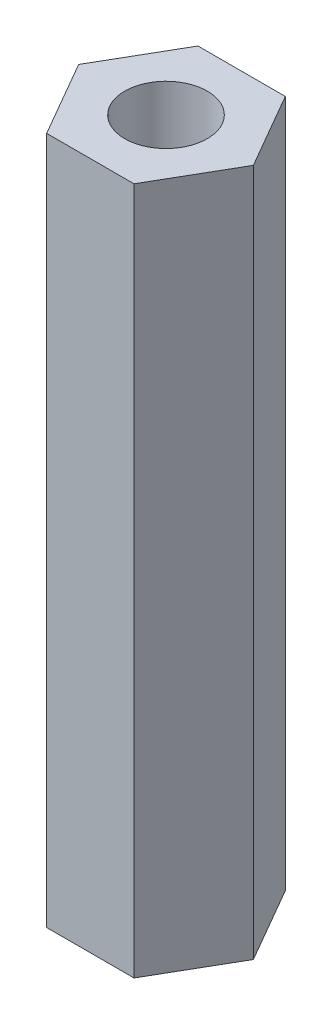
from build123d import *

# Parameters (mm, degrees)
SKETCH_1_R      = 1.5
EXTRUDE_1_DEPTH = 25


with BuildPart() as part:
    # 草图1 → 凸台-拉伸1 (new body)
    with BuildSketch(Plane(origin=(0, 0, 0), x_dir=(1, 0, 0), z_dir=(0, 1, 0))):
        Polygon((-4.147179809, 7.572240595), (-5.734893049, 10.322240595), (-8.91031953, 10.322240595), (-10.49803277, 7.572240595), (-8.91031953, 4.822240595), (-5.734893049, 4.822240595), align=None)
        with Locations(Location((-7.322606289, 7.572240595, 0), (0, 0, 270))):
            Circle(SKETCH_1_R, mode=Mode.SUBTRACT)
    extrude(amount=EXTRUDE_1_DEPTH)


solid = part.part
